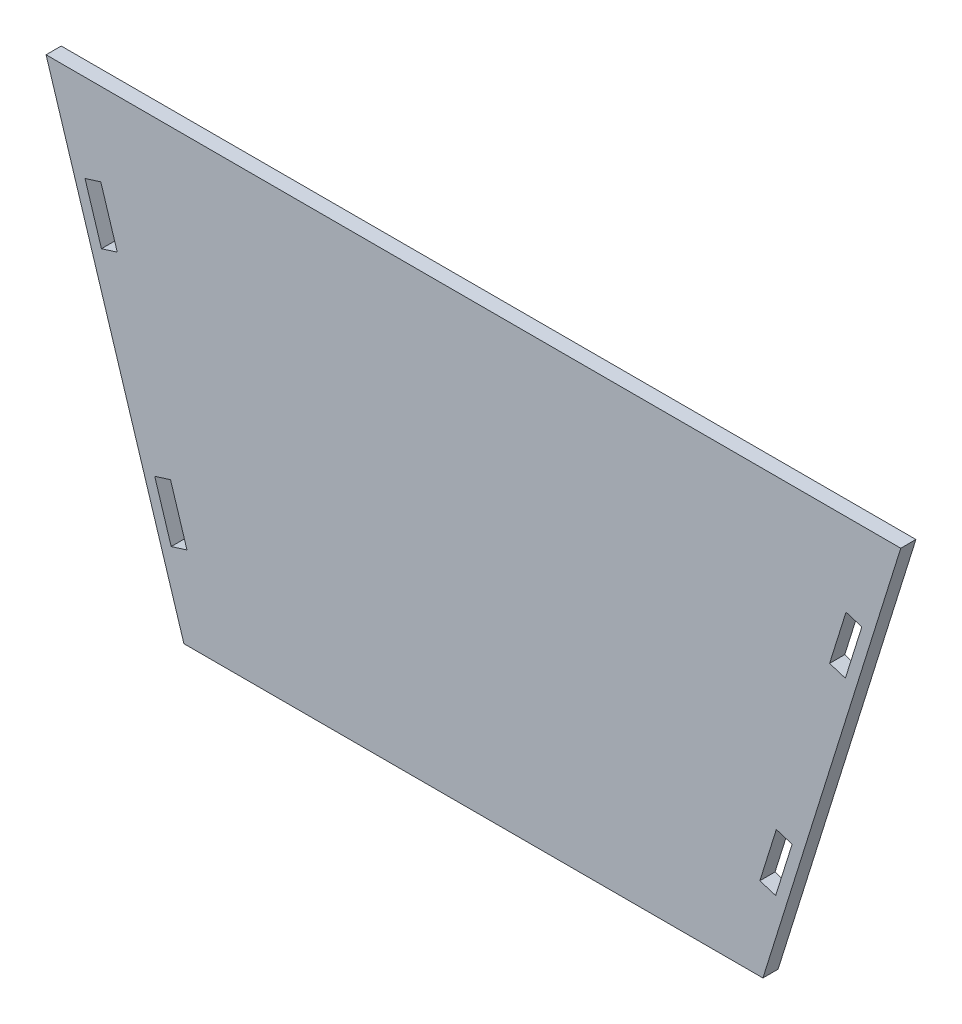
from build123d import *

# Parameters (mm, degrees)
BOSS_EXTRUDE1_DEPTH = 2.75
CUT_EXTRUDE1_DEPTH  = 10


with BuildPart() as part:
    # Sketch1 → Boss-Extrude1 (new body)
    with BuildSketch(Plane.XY):
        Polygon((-52.5, 0), (52.5, 0), (77.5, 80), (-77.5, 80), align=None)
    extrude(amount=BOSS_EXTRUDE1_DEPTH)

    # Sketch4 → Cut-Extrude1 (cut)
    with BuildSketch(Plane.XY.offset(2.75)):
        Polygon((70.437485367, 64.105175021), (67.454735436, 54.56037524), (64.591295502, 55.45520022), (67.574045433, 65), align=None)
        Polygon((57.795235299, 23.649974801), (54.812485367, 14.105175021), (51.949045433, 15), (54.931795364, 24.54479978), align=None)
        Polygon((-54.931795364, 24.54479978), (-51.949045433, 15), (-54.812485367, 14.105175021), (-57.795235299, 23.649974801), align=None)
        Polygon((-67.574045433, 65), (-64.591295502, 55.45520022), (-67.454735436, 54.56037524), (-70.437485367, 64.105175021), align=None)
    extrude(amount=-CUT_EXTRUDE1_DEPTH, mode=Mode.SUBTRACT)


solid = part.part
